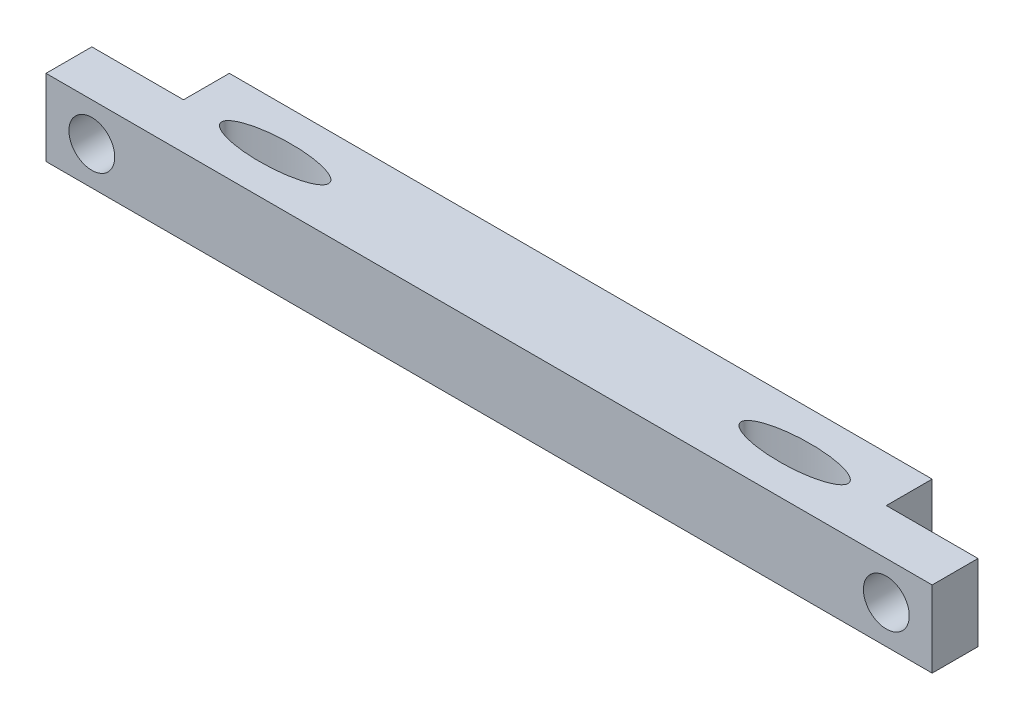
from build123d import *

# Parameters (mm, degrees)
SKETCH1_W           = 116
SKETCH1_H           = 12
BOSS_EXTRUDE1_DEPTH = 10
SKETCH2_W           = 12
SKETCH2_H           = 6
CUT_EXTRUDE1_DEPTH  = 60.160797831
SKETCH3_W           = 12
SKETCH3_H           = 6
CUT_EXTRUDE2_DEPTH  = 60.160797831
SKETCH4_RX          = 7
SKETCH4_RY          = 2.03764
CUT_EXTRUDE3_DEPTH  = 60.160797831
SKETCH5_R           = 3.000001601
CUT_EXTRUDE4_DEPTH  = 59.523499671
SKETCH6_R           = 3.000001601
CUT_EXTRUDE5_DEPTH  = 59.523499671
SKETCH7_RX          = 7
SKETCH7_RY          = 2.03764
CUT_EXTRUDE6_DEPTH  = 60.160797956


with BuildPart() as part:
    # Sketch1 → Boss-Extrude1 (new body)
    with BuildSketch(Plane.XZ.offset(5)):
        Rectangle(SKETCH1_W, SKETCH1_H)
    extrude(amount=-BOSS_EXTRUDE1_DEPTH)

    # Sketch2 → Cut-Extrude1 (cut, through all)
    with BuildSketch(Plane(origin=(0, 5, 0), x_dir=(-1, 0, 0), z_dir=(0, 1, 0))):
        with Locations((52, -3)):
            Rectangle(SKETCH2_W, SKETCH2_H)
    extrude(amount=-CUT_EXTRUDE1_DEPTH, mode=Mode.SUBTRACT)

    # Sketch3 → Cut-Extrude2 (cut, through all)
    with BuildSketch(Plane(origin=(0, 5, 0), x_dir=(-1, 0, 0), z_dir=(0, 1, 0))):
        with Locations((-52, -3)):
            Rectangle(SKETCH3_W, SKETCH3_H)
    extrude(amount=-CUT_EXTRUDE2_DEPTH, mode=Mode.SUBTRACT)

    # Sketch4 → Cut-Extrude3 (cut, through all)
    with BuildSketch(Plane.XZ.offset(5)):
        with Locations((34, 0)):
            Ellipse(SKETCH4_RX, SKETCH4_RY)
    extrude(amount=-CUT_EXTRUDE3_DEPTH, mode=Mode.SUBTRACT)

    # Sketch5 → Cut-Extrude4 (cut, through all)
    with BuildSketch(Plane(origin=(0, 0, 0), x_dir=(-1, 0, 0), z_dir=(0, 0, -1))):
        with Locations(Location((52, 0, 0), (0, 0, 90))):
            Circle(SKETCH5_R)
    extrude(amount=-CUT_EXTRUDE4_DEPTH, mode=Mode.SUBTRACT)

    # Sketch6 → Cut-Extrude5 (cut, through all)
    with BuildSketch(Plane(origin=(0, 0, 0), x_dir=(-1, 0, 0), z_dir=(0, 0, -1))):
        with Locations(Location((-52, 0, 0), (0, 0, 90))):
            Circle(SKETCH6_R)
    extrude(amount=-CUT_EXTRUDE5_DEPTH, mode=Mode.SUBTRACT)

    # Sketch7 → Cut-Extrude6 (cut, through all)
    with BuildSketch(Plane(origin=(0, 5, 0), x_dir=(-1, 0, 0), z_dir=(0, 1, 0))):
        with Locations((34, 0)):
            Ellipse(SKETCH7_RX, SKETCH7_RY)
    extrude(amount=-CUT_EXTRUDE6_DEPTH, mode=Mode.SUBTRACT)


solid = part.part
